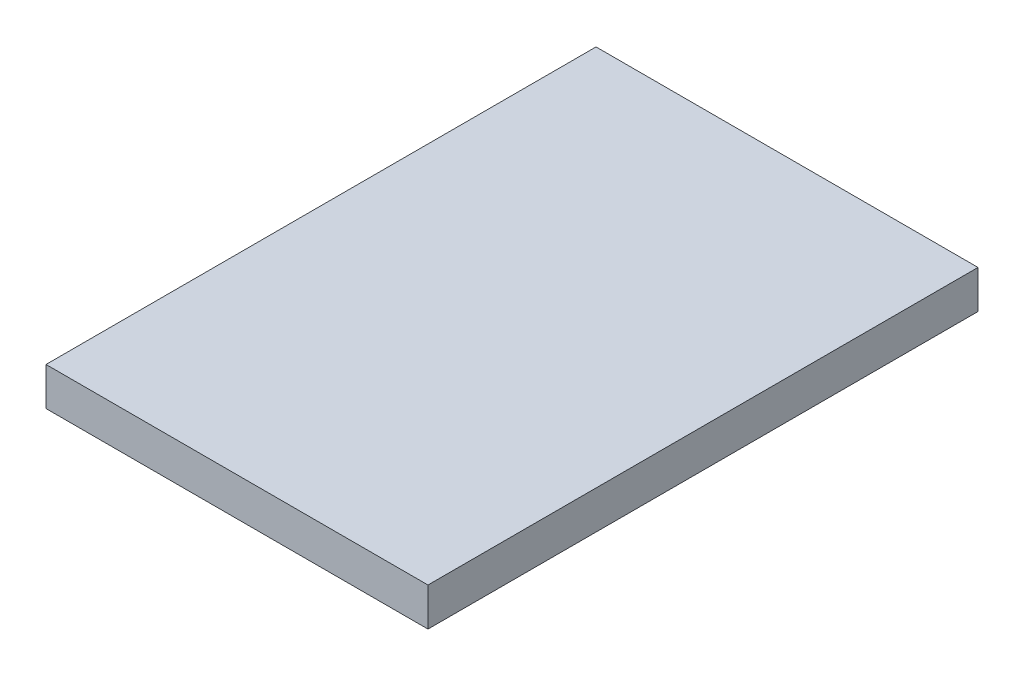
from build123d import *

# Parameters (mm, degrees)
SKETCH1_W           = 50
SKETCH1_H           = 72
BOSS_EXTRUDE1_DEPTH = 5


with BuildPart() as part:
    # Sketch1 → Boss-Extrude1 (new body)
    with BuildSketch(Plane(origin=(0, 0, 0), x_dir=(1, 0, 0), z_dir=(0, 1, 0))):
        with Locations((25, 36)):
            Rectangle(SKETCH1_W, SKETCH1_H)
    extrude(amount=BOSS_EXTRUDE1_DEPTH)


solid = part.part
